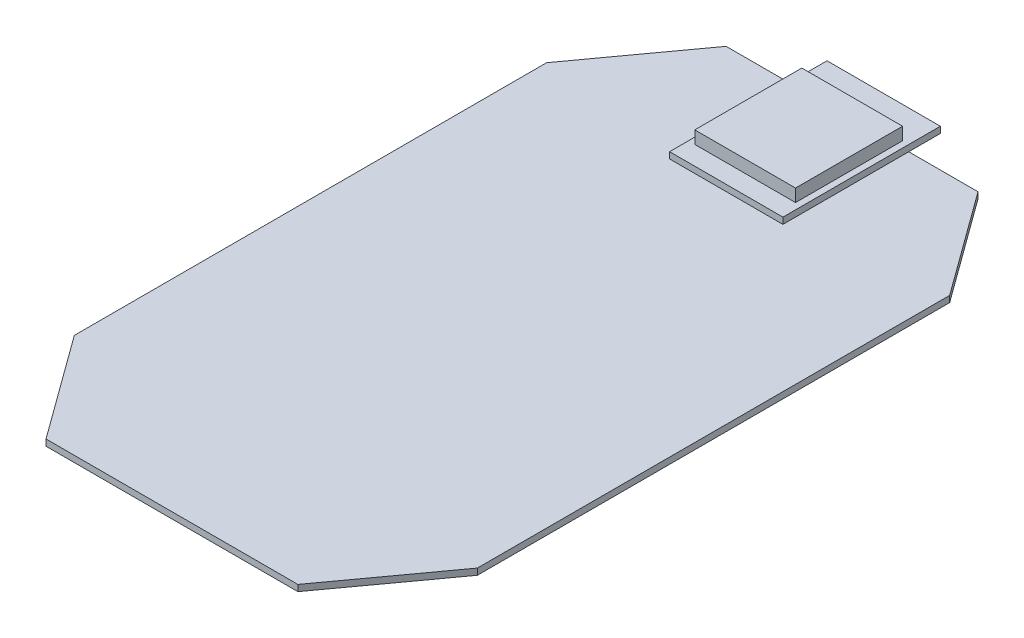
from build123d import *

# Parameters (mm, degrees)
BOSS_EXTRUDE3_DEPTH = 1
SKETCH5_W           = 8
SKETCH5_H           = 17
BOSS_EXTRUDE4_DEPTH = 3
SKETCH6_W           = 18
SKETCH6_H           = 25
BOSS_EXTRUDE5_DEPTH = 1
SKETCH7_W           = 18
SKETCH7_H           = 5.023609272
CUT_EXTRUDE4_DEPTH  = 1


with BuildPart() as part:
    # Sketch1 → Boss-Extrude3 (new body)
    with BuildSketch(Plane(origin=(0, 0, 0), x_dir=(1, 0, 0), z_dir=(0, 1, 0))):
        Polygon((-12, 54), (20, 54), (20, 108), (11, 108), (0, 108), (-12, 91.5), align=None)
        Polygon((20, 108), (20, 54), (52, 54), (52, 91.5), (40, 108), (29, 108), align=None)
        Polygon((-12, 16.5), (0, 0), (20, 0), (20, 54), (-12, 54), align=None)
        Polygon((20, 54), (20, 0), (40, 0), (52, 16.5), (52, 54), align=None)
        Polygon((11, 108), (20, 108), (29, 108), (29, 113.023609272), (11, 113.023609272), align=None)
    extrude(amount=BOSS_EXTRUDE3_DEPTH)

    # Sketch5 → Boss-Extrude4 (add)
    with BuildSketch(Plane(origin=(0, 1, 0), x_dir=(1, 0, 0), z_dir=(0, 1, 0))):
        with Locations((16, 99.523609272)):
            Rectangle(SKETCH5_W, SKETCH5_H)
        with Locations((24, 99.523609272)):
            Rectangle(SKETCH5_W, SKETCH5_H)
    extrude(amount=BOSS_EXTRUDE4_DEPTH)

    # Sketch6 → Boss-Extrude5 (add)
    with BuildSketch(Plane(origin=(0, 1, 0), x_dir=(1, 0, 0), z_dir=(0, 1, 0))):
        with Locations((20, 100.523609272)):
            Rectangle(SKETCH6_W, SKETCH6_H)
    extrude(amount=BOSS_EXTRUDE5_DEPTH)

    # Sketch7 → Cut-Extrude4 (cut)
    with BuildSketch(Plane.XZ):
        with Locations((20, -110.511804636)):
            Rectangle(SKETCH7_W, SKETCH7_H)
    extrude(amount=-CUT_EXTRUDE4_DEPTH, mode=Mode.SUBTRACT)


solid = part.part
